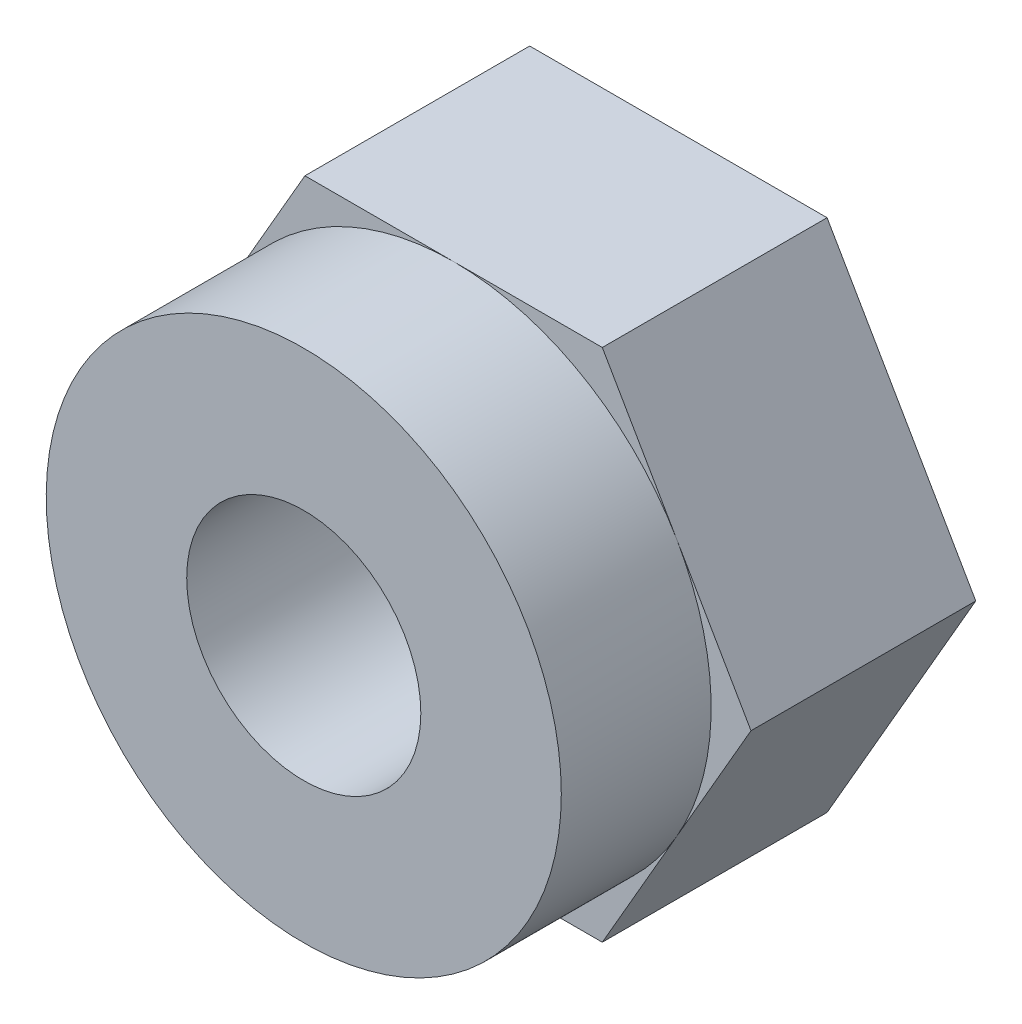
from build123d import *

# Parameters (mm, degrees)
ESQUISSE1_R        = 1.25
BOSS_EXTRU_1_DEPTH = 2.4
ESQUISSE2_R        = 2.75
ESQUISSE2_R_2      = 1.25
BOSS_EXTRU_2_DEPTH = 4


with BuildPart() as part:
    # Esquisse1 → Boss.-Extru.1 (new body)
    with BuildSketch(Plane.XY):
        Polygon((3.175426481, 0), (1.58771324, 2.75), (-1.58771324, 2.75), (-3.175426481, 0), (-1.58771324, -2.75), (1.58771324, -2.75), align=None)
        Circle(ESQUISSE1_R, mode=Mode.SUBTRACT)
    extrude(amount=BOSS_EXTRU_1_DEPTH)

    # Esquisse2 → Boss.-Extru.2 (add)
    with BuildSketch(Plane.XY):
        with Locations(Location((0, 0, 0), (0, 0, 150))):
            Circle(ESQUISSE2_R)
        Circle(ESQUISSE2_R_2, mode=Mode.SUBTRACT)
    extrude(amount=BOSS_EXTRU_2_DEPTH)


solid = part.part
